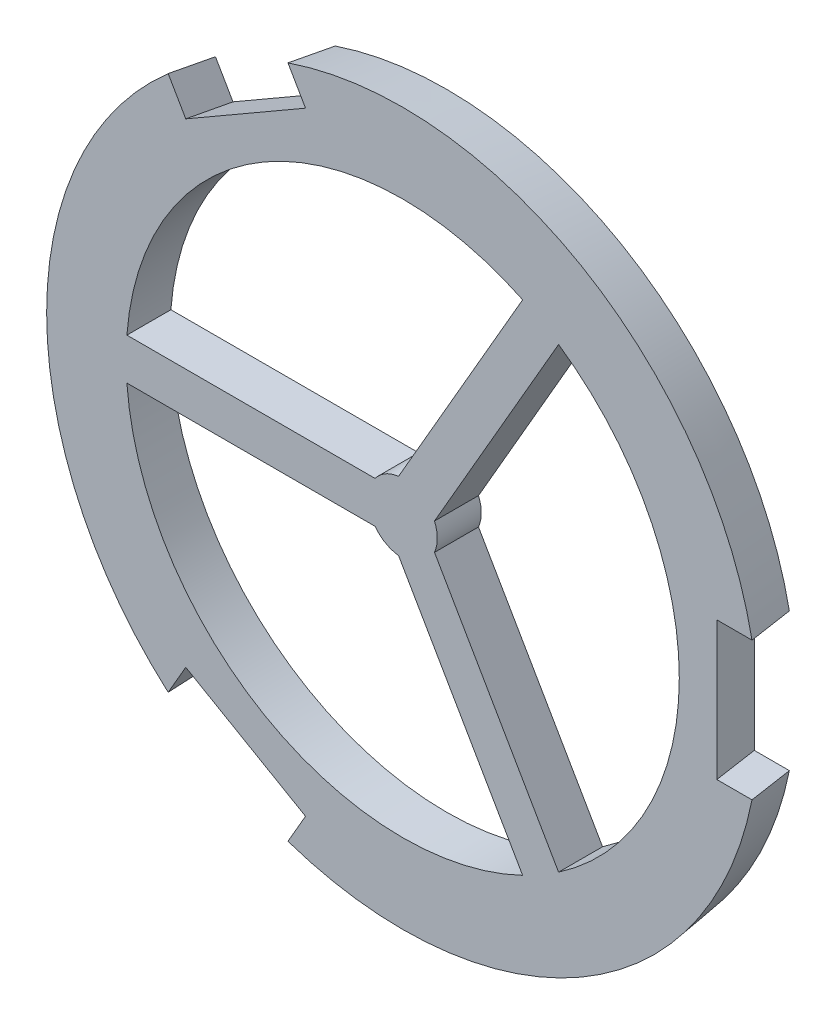
from build123d import *

# Parameters (mm, degrees)
CUT_EXTRUDE1_DEPTH = 5
CIRPATTERN1_COUNT  = 3
CUT_EXTRUDE2_DEPTH = 3.180622175


with BuildPart() as part:
    # Sketch1 → Revolve1 (revolve)
    with BuildSketch(Plane(origin=(0, 0, 0), x_dir=(1, 0, 0), z_dir=(0, 1, 0)), mode=Mode.PRIVATE) as revolve1_sk:
        Polygon((0, -208.182219687), (25.746837518, -208.182219687), (25.276959566, -205.001597513), (0, -205.001597513), align=None)
    revolve(revolve1_sk.sketch.rotate(Axis((0, 0, 0), (0, 0, 1)), 180), axis=Axis((0, 0, 0), (0, 0, 1)))

    # Sketch2 → Cut-Extrude1 (cut, symmetric)
    with BuildSketch(Plane(origin=(0, 0, 0), x_dir=(1, 0, 0), z_dir=(0, 1, 0))):
        Polygon((22.094125947, -203.98439075), (22.850570101, -209.104790721), (26.737620159, -209.104790721), (25.746837518, -203.98439075), align=None)
    cut_extrude1 = extrude(amount=CUT_EXTRUDE1_DEPTH, both=True, mode=Mode.SUBTRACT)

    # CirPattern1: Cut-Extrude1 ×3 about axis
    cirpattern1_axis = Axis((0, 0, 0), (0, 0, 1))
    for i in range(1, CIRPATTERN1_COUNT):
        add(cut_extrude1.rotate(cirpattern1_axis, i * 360 / CIRPATTERN1_COUNT), mode=Mode.SUBTRACT)

    # Sketch3 → Cut-Extrude2 (cut)
    with BuildSketch(Plane(origin=(0, 0, 205.001597513), x_dir=(-1, 0, 0), z_dir=(0, 0, -1))):
        with BuildLine():
            Line((-11.270873443, -16.521725449), (-2.299038106, -0.982050808))
            ThreePointArc((-2.299038106, -0.982050808), (-2.5, 0), (-2.299038106, 0.982050808))
            Line((-2.299038106, 0.982050808), (-11.270873443, 16.521725449))
            ThreePointArc((-11.270873443, 16.521725449), (-20, 0), (-11.270873443, -16.521725449))
        make_face()
        with BuildLine():
            ThreePointArc((19.943670675, 1.5), (10, 17.320508076), (-8.672797232, 18.021725449))
            Line((-8.672797232, 18.021725449), (0.299038106, 2.482050808))
            ThreePointArc((0.299038106, 2.482050808), (1.25, 2.165063509), (2, 1.5))
            Line((2, 1.5), (19.943670675, 1.5))
        make_face()
        with BuildLine():
            Line((0.299038106, -2.482050808), (-8.672797232, -18.021725449))
            ThreePointArc((-8.672797232, -18.021725449), (10, -17.320508076), (19.943670675, -1.5))
            Line((19.943670675, -1.5), (2, -1.5))
            ThreePointArc((2, -1.5), (1.25, -2.165063509), (0.299038106, -2.482050808))
        make_face()
    extrude(amount=-CUT_EXTRUDE2_DEPTH, mode=Mode.SUBTRACT)


solid = part.part
